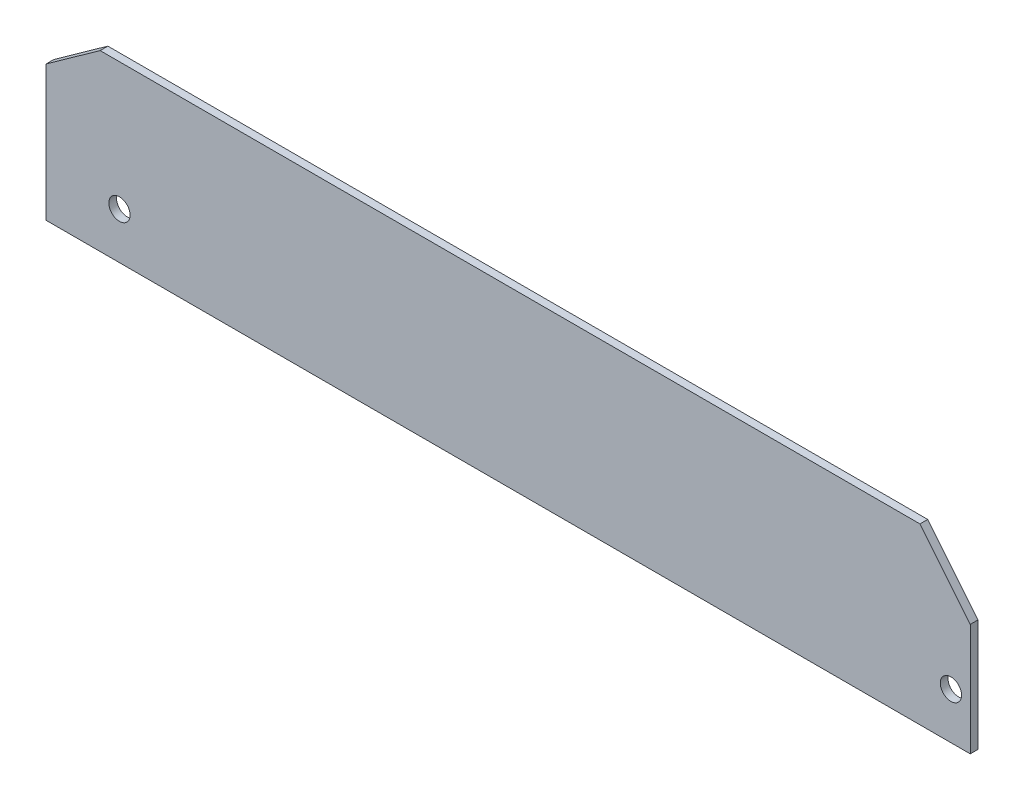
from build123d import *

# Parameters (mm, degrees)
LOW_SIDE_SHIELD_WITH_ENDS_CHAMFERED_PROF_R = 2.75
LOW_SIDE_SHIELD_WITH_ENDS_CHAMFERED_DEPTH  = 2


with BuildPart() as part:
    # Low side shield with ends chamfered profile → Low side shield with ends chamfered (new body)
    with BuildSketch(Plane.XY):
        Polygon((-136, 7), (103, 7), (103, 36), (90, 52), (-122, 52), (-136, 42), align=None)
        with Locations((-117, 19)):
            Circle(LOW_SIDE_SHIELD_WITH_ENDS_CHAMFERED_PROF_R, mode=Mode.SUBTRACT)
        with Locations((98, 19)):
            Circle(LOW_SIDE_SHIELD_WITH_ENDS_CHAMFERED_PROF_R, mode=Mode.SUBTRACT)
    extrude(amount=LOW_SIDE_SHIELD_WITH_ENDS_CHAMFERED_DEPTH)


solid = part.part
